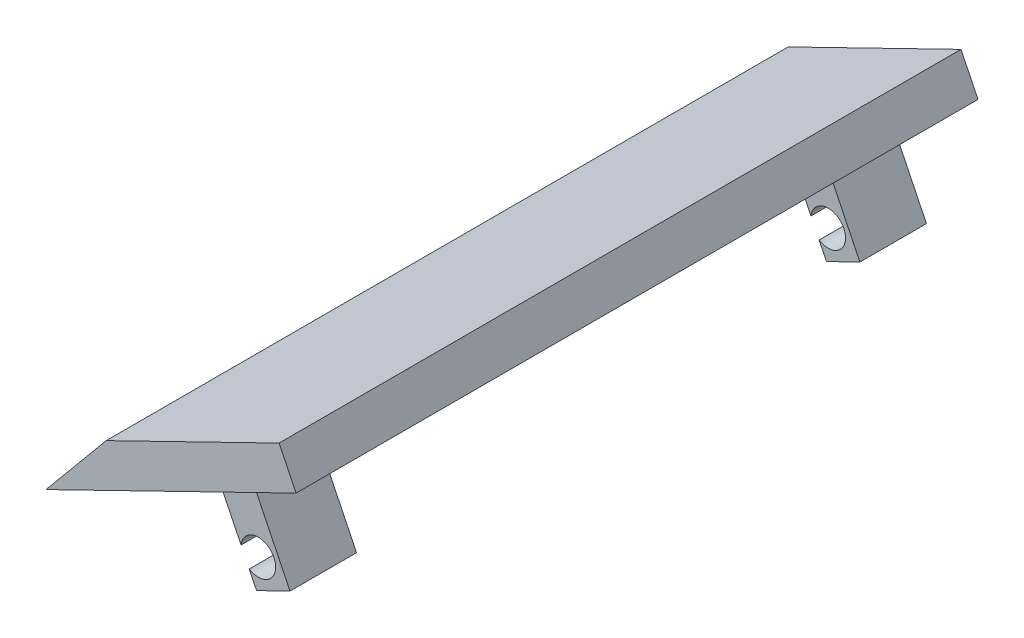
from build123d import *

# Parameters (mm, degrees)
BOSS_EXTRUDE1_DEPTH = 110
SKETCH3_W           = 6
SKETCH3_H           = 10.73706506
BOSS_EXTRUDE3_DEPTH = 14
SKETCH18_R          = 2.8
CUT_EXTRUDE4_DEPTH  = 117.507131621


with BuildPart() as part:
    # Sketch1 → Boss-Extrude1 (new body)
    with BuildSketch(Plane.XY):
        Polygon((0, 0), (9.717159864, 11.695735532), (18.078758039, 15.773959455), (37.597840156, 25.294051902), (40.338683398, 19.674490473), align=None)
    extrude(amount=BOSS_EXTRUDE1_DEPTH)

    # Sketch3 → Boss-Extrude3 (add)
    with BuildSketch(Plane(origin=(0, 0, 0), x_dir=(0.8987940462991665, 0.43837114678907857, 0), z_dir=(0.43837114678907857, -0.8987940462991665, 0))):
        with Locations((29.880897425, 100.965437953)):
            Rectangle(SKETCH3_W, SKETCH3_H)
        with Locations((29.880897425, 9.034562047)):
            Rectangle(SKETCH3_W, SKETCH3_H)
    extrude(amount=BOSS_EXTRUDE3_DEPTH)

    # Sketch18 → Cut-Extrude4 (cut, through all)
    with BuildSketch(Plane(origin=(0, 0, 3.666029517), x_dir=(-1, 0, 0), z_dir=(0, 0, -1))):
        with Locations((-30.580685329, 4.011697799)):
            Circle(SKETCH18_R)
    extrude(amount=-CUT_EXTRUDE4_DEPTH, mode=Mode.SUBTRACT)


solid = part.part
